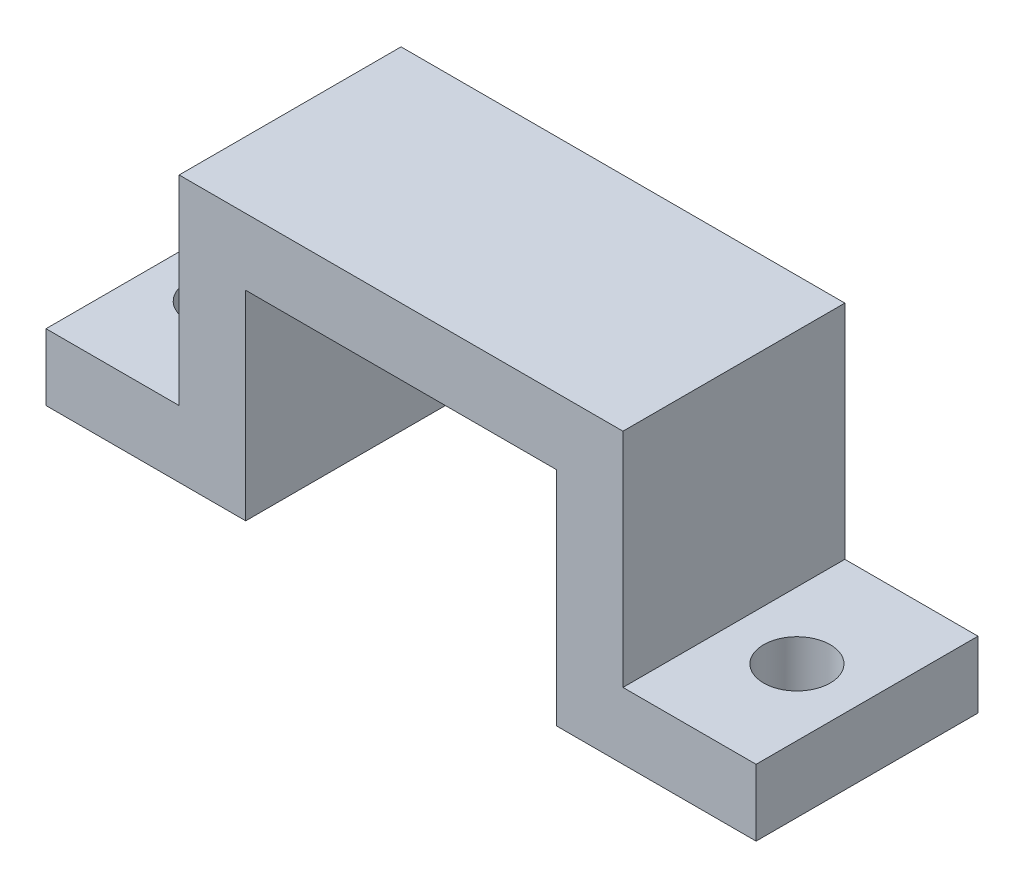
from build123d import *

# Parameters (mm, degrees)
SKETCH1_W           = 9
SKETCH1_H           = 10
BOSS_EXTRUDE1_DEPTH = 3
SKETCH2_W           = 3
SKETCH2_H           = 10
BOSS_EXTRUDE2_DEPTH = 9
SKETCH3_W           = 10
SKETCH3_H           = 3
BOSS_EXTRUDE3_DEPTH = 17
SKETCH4_W           = 3
SKETCH4_H           = 10
BOSS_EXTRUDE4_DEPTH = 10
SKETCH5_W           = 10
SKETCH5_H           = 3
BOSS_EXTRUDE5_DEPTH = 6
CUT_EXTRUDE1_DEPTH  = 6


with BuildPart() as part:
    # Sketch1 → Boss-Extrude1 (new body)
    with BuildSketch(Plane(origin=(0, 0, 0), x_dir=(1, 0, 0), z_dir=(0, 1, 0))):
        with Locations((4.5, 5)):
            Rectangle(SKETCH1_W, SKETCH1_H)
    extrude(amount=BOSS_EXTRUDE1_DEPTH)

    # Sketch2 → Boss-Extrude2 (add)
    with BuildSketch(Plane(origin=(0, 3, 0), x_dir=(1, 0, 0), z_dir=(0, 1, 0))):
        with Locations((7.5, 5)):
            Rectangle(SKETCH2_W, SKETCH2_H)
    extrude(amount=BOSS_EXTRUDE2_DEPTH)

    # Sketch3 → Boss-Extrude3 (add)
    with BuildSketch(Plane(origin=(9, 0, 0), x_dir=(0, 0, -1), z_dir=(1, 0, 0))):
        with Locations((5, 10.5)):
            Rectangle(SKETCH3_W, SKETCH3_H)
    extrude(amount=BOSS_EXTRUDE3_DEPTH)

    # Sketch4 → Boss-Extrude4 (add)
    with BuildSketch(Plane.XZ.offset(-9)):
        with Locations((24.5, -5)):
            Rectangle(SKETCH4_W, SKETCH4_H)
    extrude(amount=BOSS_EXTRUDE4_DEPTH)

    # Sketch5 → Boss-Extrude5 (add)
    with BuildSketch(Plane(origin=(26, 0, 0), x_dir=(0, 0, -1), z_dir=(1, 0, 0))):
        with Locations((5, 0.5)):
            Rectangle(SKETCH5_W, SKETCH5_H)
    extrude(amount=BOSS_EXTRUDE5_DEPTH)

    # Sketch6 → Cut-Extrude1 (cut)
    with BuildSketch(Plane(origin=(0, 3, 0), x_dir=(1, 0, 0), z_dir=(0, 1, 0))):
        with BuildLine():
            ThreePointArc((4.351556364, 5), (3.912216535, 6.060660172), (2.851556364, 6.5))
            Line((2.851556364, 6.5), (2.851556364, 5))
            Line((2.851556364, 5), (4.351556364, 5))
        make_face()
        with BuildLine():
            Line((2.851556364, 5), (2.851556364, 6.5))
            ThreePointArc((2.851556364, 6.5), (1.790896192, 6.060660172), (1.351556364, 5))
            Line((1.351556364, 5), (2.851556364, 5))
        make_face()
        with BuildLine():
            Line((4.351556364, 5), (2.851556364, 5))
            Line((2.851556364, 5), (2.851556364, 3.5))
            ThreePointArc((2.851556364, 3.5), (3.912216535, 3.939339828), (4.351556364, 5))
        make_face()
        with BuildLine():
            Line((2.851556364, 3.5), (2.851556364, 5))
            Line((2.851556364, 5), (1.351556364, 5))
            ThreePointArc((1.351556364, 5), (1.790896192, 3.939339828), (2.851556364, 3.5))
        make_face()
        with BuildLine():
            ThreePointArc((30.491456548, 5), (30.002546741, 5.955884174), (29, 6.340133291))
            Line((29, 6.340133291), (29, 5))
            Line((29, 5), (30.491456548, 5))
        make_face()
        with BuildLine():
            Line((29, 5), (29, 6.340133291))
            ThreePointArc((29, 6.340133291), (27.997453259, 5.955884174), (27.508543452, 5))
            Line((27.508543452, 5), (29, 5))
        make_face()
        with BuildLine():
            Line((30.491456548, 5), (29, 5))
            Line((29, 5), (29, 3.340133291))
            ThreePointArc((29, 3.340133291), (30.060660172, 3.779473119), (30.5, 4.840133291))
            ThreePointArc((30.5, 4.840133291), (30.497862614, 4.920180707), (30.491456548, 5))
        make_face()
        with BuildLine():
            Line((29, 3.340133291), (29, 5))
            Line((29, 5), (27.508543452, 5))
            ThreePointArc((27.508543452, 5), (27.884249118, 3.83758655), (29, 3.340133291))
        make_face()
    extrude(amount=-CUT_EXTRUDE1_DEPTH, mode=Mode.SUBTRACT)


solid = part.part
